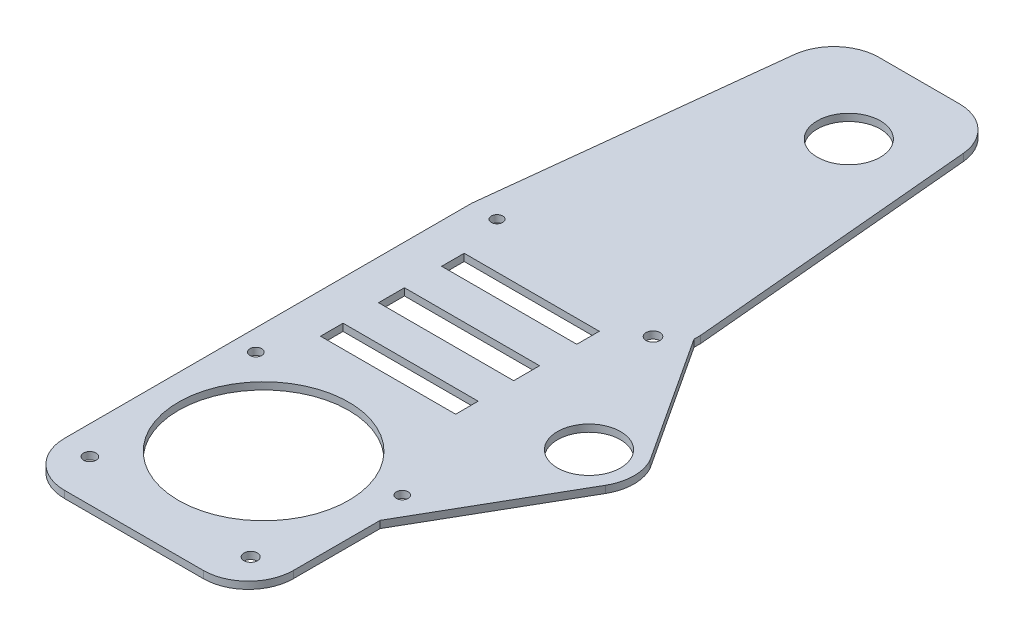
from build123d import *

# Parameters (mm, degrees)
SKETCH1_R           = 2.875
SKETCH1_R_2         = 7
BOSS_EXTRUDE1_DEPTH = 24.5875
SKETCH4_W           = 66.272407177
SKETCH4_H           = 27.800260981
CUT_EXTRUDE2_DEPTH  = 20
FILLET3_R           = 10
FILLET4_R           = 10
BOSS_EXTRUDE3_START = -1.5875
BOSS_EXTRUDE3_DEPTH = 1.5875
SKETCH7_R           = 7
CUT_EXTRUDE3_DEPTH  = 1.5875
CUT_EXTRUDE4_START  = -10
SKETCH8_R           = 3
SKETCH8_R_2         = 18.9
SKETCH8_R_3         = 2.875
SKETCH8_R_4         = 7
CUT_EXTRUDE4_DEPTH  = 10
SKETCH9_W           = 229.1070397
SKETCH9_H           = 361.266964835
SKETCH9_R           = 1.388229101
SKETCH9_R_2         = 1.483383261
SKETCH9_R_3         = 1.314910669
SKETCH9_R_4         = 1.248623853
SKETCH9_R_5         = 1.255629307
SKETCH9_R_6         = 1.53911217
CUT_EXTRUDE5_DEPTH  = 13
SKETCH10_W          = 29.988446547
SKETCH10_H          = 5
SKETCH10_H_2        = 5.75
CUT_EXTRUDE6_DEPTH  = 22
SKETCH11_R          = 5.236653548
CUT_EXTRUDE7_DEPTH  = 10
BOSS_EXTRUDE4_START = -1.59
BOSS_EXTRUDE4_DEPTH = 1.59
SKETCH13_R          = 7
CUT_EXTRUDE8_DEPTH  = 41
SKETCH14_W          = 61.491848917
SKETCH14_H          = 35.587491391
CUT_EXTRUDE9_DEPTH  = 20
FILLET5_R           = 10
SKETCH16_W          = 163.723031551
SKETCH16_H          = 22.872070304
CUT_EXTRUDE11_DEPTH = 35
FILLET6_R           = 10
SKETCH17_R          = 1.53911217
SKETCH17_R_2        = 1.255629307
SKETCH17_R_3        = 1.3
SKETCH17_R_4        = 1.314910669
SKETCH17_R_5        = 1.388229101
SKETCH17_R_6        = 1.5
CUT_EXTRUDE12_DEPTH = 42
CUT_EXTRUDE13_START = -30
SKETCH18_R          = 18.9
CUT_EXTRUDE13_DEPTH = 30


with BuildPart() as part:
    # Sketch1 → Boss-Extrude1 (new body)
    with BuildSketch(Plane(origin=(0, 0, 0), x_dir=(1, 0, 0), z_dir=(0, 1, 0))):
        with BuildLine():
            Line((42.32729629, 228.6), (10.454309325, 228.6))
            Line((10.454309325, 228.6), (0, 135.362739137))
            Line((0, 135.362739137), (0, 0))
            Line((0, 0), (24.327009544, 0))
            Line((24.327009544, 0), (50.8, 0))
            Line((50.8, 0), (50.8, 64.87909603))
            Line((50.8, 64.87909603), (50.8, 87.423477361))
            Line((50.8, 87.423477361), (50.8, 98.200996728))
            ThreePointArc((50.8, 98.200996728), (50.4, 101.000996728), (50.8, 103.800996728))
            Line((50.8, 103.800996728), (50.8, 104.488200565))
            Line((50.8, 104.488200565), (50.8, 120.619222808))
            Line((50.8, 120.619222808), (50.8, 135.362739137))
            Line((50.8, 135.362739137), (42.32729629, 228.6))
        make_face()
        with Locations(Location((24.101759227, 108.78493524, 0), (0, 0, 270))):
            Circle(SKETCH1_R, mode=Mode.SUBTRACT)
        with Locations(Location((29.504213454, 189.557234372, 0), (0, 0, 270))):
            Circle(SKETCH1_R_2, mode=Mode.SUBTRACT)
    extrude(amount=BOSS_EXTRUDE1_DEPTH)

    # Sketch4 → Cut-Extrude2 (cut)
    with BuildSketch(Plane(origin=(0, 0, -228.6), x_dir=(-1, 0, 0), z_dir=(0, 0, -1))):
        with Locations((-28.174690156, -1.980940155)):
            Rectangle(SKETCH4_W, SKETCH4_H)
    extrude(amount=-CUT_EXTRUDE2_DEPTH, mode=Mode.SUBTRACT)

    # Fillet3
    fillet3_edges = [part.edges().sort_by_distance(p)[0] for p in [
        (44.144746445, 5.959595168, -208.6),
    ]]
    fillet(fillet3_edges, radius=FILLET3_R)

    # Fillet4
    fillet4_edges = [part.edges().sort_by_distance(p)[0] for p in [
        (50.8, 12.29375, 0),
        (0, 12.29375, 0),
        (8.211791854, 5.959595168, -208.6),
    ]]
    fillet(fillet4_edges, radius=FILLET4_R)

    # Sketch6 → Boss-Extrude3 (add)
    with BuildSketch(Plane(origin=(0, 24.5875, 0), x_dir=(1, 0, 0), z_dir=(0, 1, 0)).offset(BOSS_EXTRUDE3_START)):
        with BuildLine():
            Line((50.8, 135.362739137), (50.8, 103.800996728))
            ThreePointArc((50.8, 103.800996728), (50.4, 101.000996728), (50.8, 98.200996728))
            Line((50.8, 98.200996728), (50.8, 61.124243317))
            Line((50.8, 61.124243317), (69.258211507, 96.360728536))
            ThreePointArc((69.258211507, 96.360728536), (70.393157133, 101.370875786), (68.890940865, 106.283413148))
            Line((68.890940865, 106.283413148), (50.8, 135.362739137))
        make_face()
    extrude(amount=BOSS_EXTRUDE3_DEPTH)

    # Sketch7 → Cut-Extrude3 (cut)
    with BuildSketch(Plane(origin=(0, 24.5875, 0), x_dir=(1, 0, 0), z_dir=(0, 1, 0))):
        with Locations(Location((60.4, 101.000996728, 0), (0, 0, 270))):
            Circle(SKETCH7_R)
    extrude(amount=-CUT_EXTRUDE3_DEPTH, mode=Mode.SUBTRACT)

    # Sketch8 → Cut-Extrude4 (cut)
    with BuildSketch(Plane(origin=(0, 24.5875, 0), x_dir=(1, 0, 0), z_dir=(0, 1, 0)).offset(CUT_EXTRUDE4_START)):
        with BuildLine():
            Line((10.454309325, 228.6), (0, 135.362739137))
            Line((0, 135.362739137), (0, 10))
            ThreePointArc((0, 10), (2.928932188, 2.928932188), (10, 0))
            Line((10, 0), (40.8, 0))
            ThreePointArc((40.8, 0), (47.871067812, 2.928932188), (50.8, 10))
            Line((50.8, 10), (50.8, 61.124243317))
            Line((50.8, 61.124243317), (69.258211507, 96.360728536))
            ThreePointArc((69.258211507, 96.360728536), (70.393157133, 101.370875786), (68.890940865, 106.283413148))
            Line((68.890940865, 106.283413148), (50.8, 135.362739137))
            Line((50.8, 135.362739137), (42.32729629, 228.6))
            Line((42.32729629, 228.6), (10.454309325, 228.6))
        make_face()
        with Locations(Location((9.492033273, 118.909935242, 0), (0, 0, 270))):
            Circle(SKETCH8_R, mode=Mode.SUBTRACT)
        with Locations(Location((24.583834565, 64.593886665, 0), (0, 0, 270))):
            Circle(SKETCH8_R_2, mode=Mode.SUBTRACT)
        with Locations(Location((24.101759227, 108.78493524, 0), (0, 0, 270))):
            Circle(SKETCH8_R_3, mode=Mode.SUBTRACT)
        with Locations((60.4, 101.000996728)):
            Circle(SKETCH8_R_4, mode=Mode.SUBTRACT)
        with Locations(Location((29.504213454, 189.557234372, 0), (0, 0, 270))):
            Circle(SKETCH8_R_4, mode=Mode.SUBTRACT)
    extrude(amount=CUT_EXTRUDE4_DEPTH, mode=Mode.SUBTRACT)

    # Sketch9 → Cut-Extrude5 (cut)
    with BuildSketch(Plane.XZ):
        with Locations((19.903204009, -125.752229467)):
            Rectangle(SKETCH9_W, SKETCH9_H)
        with Locations(Location((6.335590122, -44.288799513, 0), (0, 0, 270))):
            Circle(SKETCH9_R, mode=Mode.SUBTRACT)
        with Locations(Location((43.447673368, -42.868436544, 0), (0, 0, 270))):
            Circle(SKETCH9_R_2, mode=Mode.SUBTRACT)
        with Locations(Location((4.659546827, -82.793173401, 0), (0, 0, 270))):
            Circle(SKETCH9_R_3, mode=Mode.SUBTRACT)
        with Locations(Location((48.400988852, -71.551011715, 0), (0, 0, 270))):
            Circle(SKETCH9_R_4, mode=Mode.SUBTRACT)
        with Locations(Location((5.88467603, -135.103145298, 0), (0, 0, 270))):
            Circle(SKETCH9_R_5, mode=Mode.SUBTRACT)
        with Locations(Location((45.747747887, -129.863467374, 0), (0, 0, 270))):
            Circle(SKETCH9_R_6, mode=Mode.SUBTRACT)
    extrude(amount=-CUT_EXTRUDE5_DEPTH, mode=Mode.SUBTRACT)

    # Sketch10 → Cut-Extrude6 (cut)
    with BuildSketch(Plane(origin=(0, 24.5875, 0), x_dir=(1, 0, 0), z_dir=(0, 1, 0))):
        with Locations((23.779803557, 122.41493524)):
            Rectangle(SKETCH10_W, SKETCH10_H)
        with Locations((23.779803557, 108.78493524)):
            Rectangle(SKETCH10_W, SKETCH10_H_2)
        with Locations((23.779803557, 95.528937895)):
            Rectangle(SKETCH10_W, SKETCH10_H)
    extrude(amount=-CUT_EXTRUDE6_DEPTH, mode=Mode.SUBTRACT)

    # Sketch11 → Cut-Extrude7 (cut)
    with BuildSketch(Plane(origin=(0, 24.5875, 0), x_dir=(1, 0, 0), z_dir=(0, 1, 0))):
        with Locations((8.535526315, 118.29502971)):
            Circle(SKETCH11_R)
    extrude(amount=-CUT_EXTRUDE7_DEPTH, mode=Mode.SUBTRACT)

    # Sketch12 → Boss-Extrude4 (add)
    with BuildSketch(Plane(origin=(0, 14.5875, 0), x_dir=(1, 0, 0), z_dir=(0, 1, 0)).offset(BOSS_EXTRUDE4_START)):
        with BuildLine():
            Line((68.287536191, 107.148091395), (50.8, 133.900488173))
            Line((50.8, 133.900488173), (50.8, 103.800996728))
            ThreePointArc((50.8, 103.800996728), (58.520134646, 110.822712782), (68.287536191, 107.148091395))
        make_face()
        with BuildLine():
            Line((69.19540964, 105.759228466), (68.287536191, 107.148091395))
            ThreePointArc((68.287536191, 107.148091395), (58.520134646, 110.822712782), (50.8, 103.800996728))
            ThreePointArc((50.8, 103.800996728), (50.4, 101.000996728), (50.8, 98.200996728))
            ThreePointArc((50.8, 98.200996728), (59.211240578, 91.07190558), (69.067690563, 96.013899345))
            ThreePointArc((69.067690563, 96.013899345), (70.061182785, 98.419999404), (70.4, 101.000996728))
            ThreePointArc((70.4, 101.000996728), (70.094175994, 103.455167016), (69.19540964, 105.759228466))
        make_face()
        with BuildLine():
            ThreePointArc((69.067690563, 96.013899345), (59.211240578, 91.07190558), (50.8, 98.200996728))
            Line((50.8, 98.200996728), (50.8, 64.264230765))
            Line((50.8, 64.264230765), (69.067690563, 96.013899345))
        make_face()
    extrude(amount=BOSS_EXTRUDE4_DEPTH)

    # Sketch13 → Cut-Extrude8 (cut)
    with BuildSketch(Plane(origin=(0, 14.5875, 0), x_dir=(1, 0, 0), z_dir=(0, 1, 0))):
        with Locations(Location((60.4, 101.000996728, 0), (0, 0, 270))):
            Circle(SKETCH13_R)
    extrude(amount=-CUT_EXTRUDE8_DEPTH, mode=Mode.SUBTRACT)

    # Sketch14 → Cut-Extrude9 (cut)
    with BuildSketch(Plane(origin=(0, 0, -228.6), x_dir=(-1, 0, 0), z_dir=(0, 0, -1))):
        with Locations((-33.296946078, 21.381494753)):
            Rectangle(SKETCH14_W, SKETCH14_H)
    extrude(amount=-CUT_EXTRUDE9_DEPTH, mode=Mode.SUBTRACT)

    # Fillet5
    fillet5_edges = [part.edges().sort_by_distance(p)[0] for p in [
        (44.144746445, 13.79375, -208.6),
        (8.211791854, 13.79375, -208.6),
    ]]
    fillet(fillet5_edges, radius=FILLET5_R)

    # Sketch16 → Cut-Extrude11 (cut)
    with BuildSketch(Plane.XY):
        with Locations((6.935844153, 9.456999915)):
            Rectangle(SKETCH16_W, SKETCH16_H)
    extrude(amount=-CUT_EXTRUDE11_DEPTH, mode=Mode.SUBTRACT)

    # Fillet6
    fillet6_edges = [part.edges().sort_by_distance(p)[0] for p in [
        (0, 13.79375, -35),
        (50.8, 13.79375, -35),
    ]]
    fillet(fillet6_edges, radius=FILLET6_R)

    # Sketch17 → Cut-Extrude12 (cut)
    with BuildSketch(Plane.XZ):
        with Locations(Location((45.747747887, -129.863467374, 0), (0, 0, 270))):
            Circle(SKETCH17_R)
        with Locations(Location((5.88467603, -135.103145298, 0), (0, 0, 270))):
            Circle(SKETCH17_R_2)
        with Locations(Location((48.400988852, -71.551011715, 0), (0, 0, 270))):
            Circle(SKETCH17_R_3)
        with Locations(Location((4.659546827, -82.793173401, 0), (0, 0, 270))):
            Circle(SKETCH17_R_4)
        with Locations(Location((6.335590122, -44.288799513, 0), (0, 0, 270))):
            Circle(SKETCH17_R_5)
        with Locations(Location((43.447673368, -42.868436544, 0), (0, 0, 270))):
            Circle(SKETCH17_R_6)
    extrude(amount=-CUT_EXTRUDE12_DEPTH, mode=Mode.SUBTRACT)

    # Sketch18 → Cut-Extrude13 (cut)
    with BuildSketch(Plane(origin=(0, 24.5875, 0), x_dir=(1, 0, 0), z_dir=(0, 1, 0)).offset(CUT_EXTRUDE13_START)):
        with Locations(Location((24.583834565, 64.593886665, 0), (0, 0, 270))):
            Circle(SKETCH18_R)
    extrude(amount=CUT_EXTRUDE13_DEPTH, mode=Mode.SUBTRACT)


solid = part.part
